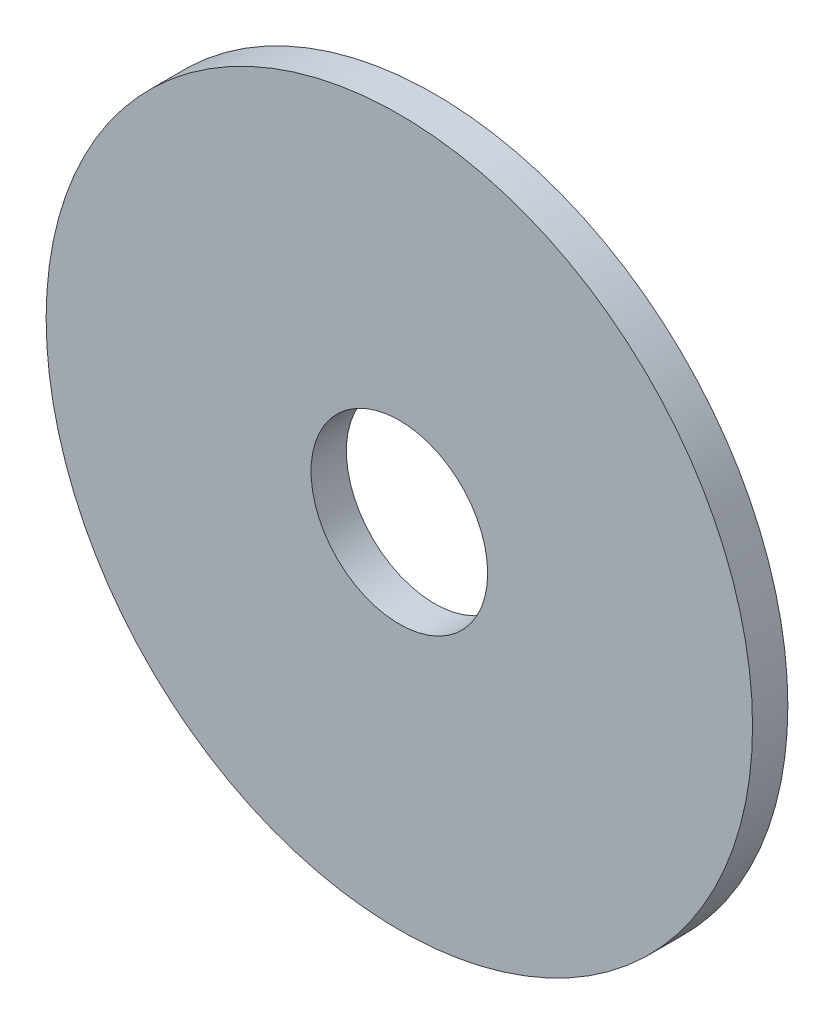
from build123d import *

# Parameters (mm, degrees)
SKETCH_1_R      = 10
SKETCH_1_R_2    = 2.5
EXTRUDE_1_DEPTH = 1


with BuildPart() as part:
    # 草图1 → 凸台-拉伸1 (new body)
    with BuildSketch(Plane.XY):
        Circle(SKETCH_1_R)
        Circle(SKETCH_1_R_2, mode=Mode.SUBTRACT)
    extrude(amount=EXTRUDE_1_DEPTH)


solid = part.part
